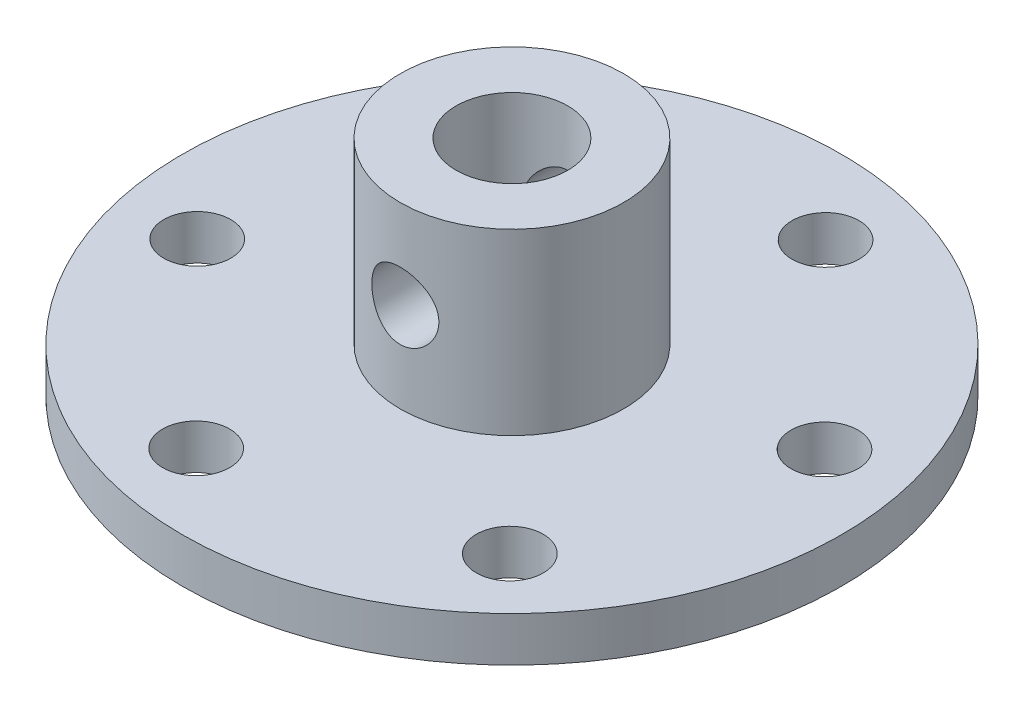
from build123d import *

# Parameters (mm, degrees)
SKETCH1_R           = 29.5
SKETCH1_R_2         = 3
BOSS_EXTRUDE1_DEPTH = 4
SKETCH2_R           = 10
SKETCH2_R_2         = 5
BOSS_EXTRUDE2_DEPTH = 16
SKETCH3_R           = 3
CUT_EXTRUDE1_DEPTH  = 13


with BuildPart() as part:
    # Sketch1 → Boss-Extrude1 (new body)
    with BuildSketch(Plane(origin=(0, 0, 0), x_dir=(1, 0, 0), z_dir=(0, 1, 0))):
        with Locations(Location((0, 0, 0), (0, 0, 270))):
            Circle(SKETCH1_R)
        with Locations(Location((-16.263455967, 16.263455967, 0), (0, 0, 270))):
            Circle(SKETCH1_R_2, mode=Mode.SUBTRACT)
        with Locations(Location((5.932823239, 22.141597761, 0), (0, 0, 270))):
            Circle(SKETCH1_R_2, mode=Mode.SUBTRACT)
        with Locations(Location((22.121582963, 5.858126996, 0), (0, 0, 270))):
            Circle(SKETCH1_R_2, mode=Mode.SUBTRACT)
        with Locations(Location((16.11406348, -16.303485564, 0), (0, 0, 270))):
            Circle(SKETCH1_R_2, mode=Mode.SUBTRACT)
        with Locations(Location((-6.082215726, -22.181627357, 0), (0, 0, 270))):
            Circle(SKETCH1_R_2, mode=Mode.SUBTRACT)
        with Locations(Location((-22.27097545, -5.898156592, 0), (0, 0, 270))):
            Circle(SKETCH1_R_2, mode=Mode.SUBTRACT)
    extrude(amount=BOSS_EXTRUDE1_DEPTH)

    # Sketch2 → Boss-Extrude2 (add)
    with BuildSketch(Plane(origin=(0, 4, 0), x_dir=(1, 0, 0), z_dir=(0, 1, 0))):
        with Locations(Location((0, 0, 0), (0, 0, 270))):
            Circle(SKETCH2_R)
        with Locations(Location((0, 0, 0), (0, 0, 270))):
            Circle(SKETCH2_R_2, mode=Mode.SUBTRACT)
    extrude(amount=BOSS_EXTRUDE2_DEPTH)

    # Sketch3 → Cut-Extrude1 (cut, symmetric)
    with BuildSketch(Plane.XY):
        with Locations((0, 12)):
            Circle(SKETCH3_R)
    extrude(amount=CUT_EXTRUDE1_DEPTH, both=True, mode=Mode.SUBTRACT)


solid = part.part
